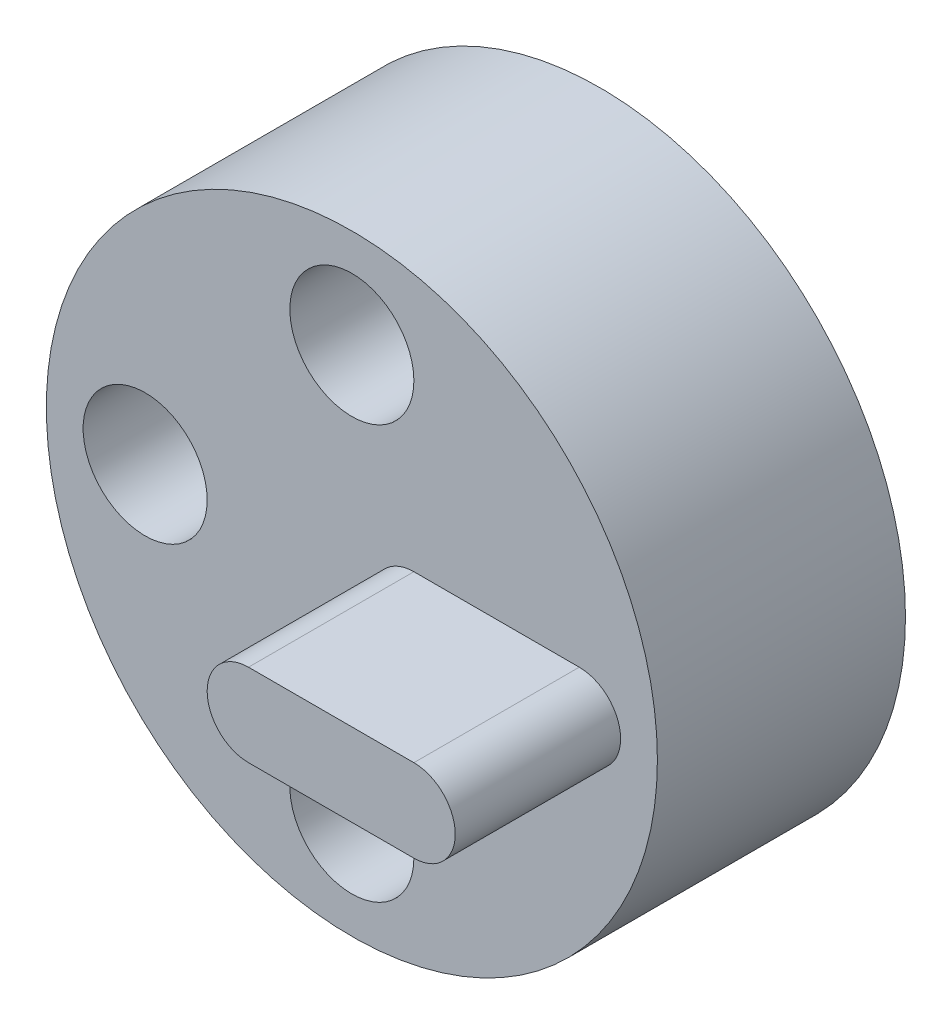
from build123d import *

# Parameters (mm, degrees)
SKETCH1_R           = 7.39
SKETCH1_R_2         = 1.5
BOSS_EXTRUDE1_DEPTH = 6
BOSS_EXTRUDE2_DEPTH = 10
SKETCH2_R           = 2.65
CUT_EXTRUDE1_DEPTH  = 4.3


with BuildPart() as part:
    # Sketch1 → Boss-Extrude1 (new body)
    with BuildSketch(Plane.XY):
        Circle(SKETCH1_R)
        with Locations((-5, 0)):
            Circle(SKETCH1_R_2, mode=Mode.SUBTRACT)
        with Locations((0, -5)):
            Circle(SKETCH1_R_2, mode=Mode.SUBTRACT)
        with BuildLine():
            ThreePointArc((5.5, 1), (6.5, 0), (5.5, -1))
            Line((5.5, -1), (1.5, -1))
            ThreePointArc((1.5, -1), (0.5, 0), (1.5, 1))
            Line((1.5, 1), (5.5, 1))
        make_face(mode=Mode.SUBTRACT)
        with Locations((0, 5)):
            Circle(SKETCH1_R_2, mode=Mode.SUBTRACT)
    extrude(amount=BOSS_EXTRUDE1_DEPTH)

    # Sketch1<3> → Boss-Extrude2 (add)
    with BuildSketch(Plane.XY):
        with BuildLine():
            Line((1.5, -1), (5.5, -1))
            ThreePointArc((5.5, -1), (6.5, 0), (5.5, 1))
            Line((5.5, 1), (1.5, 1))
            ThreePointArc((1.5, 1), (0.5, 0), (1.5, -1))
        make_face()
    extrude(amount=BOSS_EXTRUDE2_DEPTH)

    # Sketch2 → Cut-Extrude1 (cut)
    with BuildSketch(Plane(origin=(0, 0, 0), x_dir=(-1, 0, 0), z_dir=(0, 0, -1))):
        Circle(SKETCH2_R)
    extrude(amount=-CUT_EXTRUDE1_DEPTH, mode=Mode.SUBTRACT)


solid = part.part
